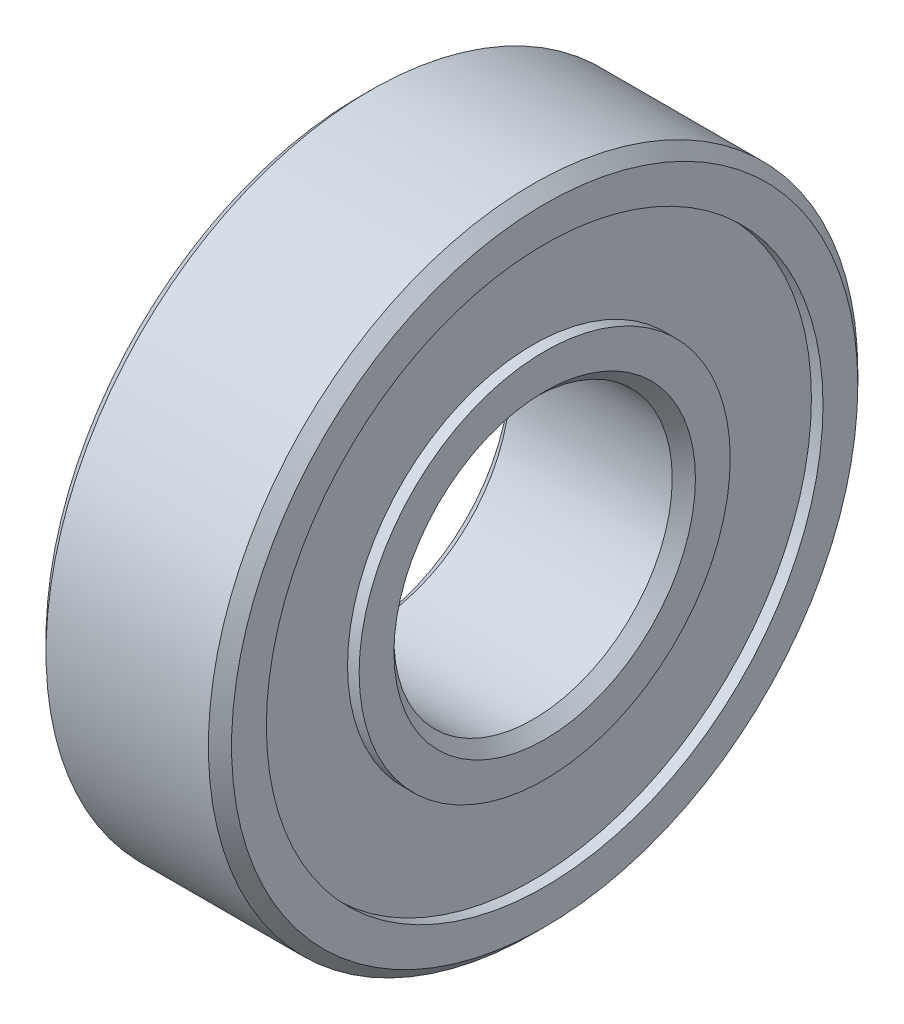
from build123d import *

# Parameters (mm, degrees)
SKETCH1_R             = 14
SKETCH1_R_2           = 12
BOSS_EXTRUDE1_DEPTH   = 4
SKETCH1_R_3           = 8
SKETCH1_R_4           = 6
BOSS_EXTRUDE1_2_DEPTH = 4
SKETCH2_R             = 12
SKETCH2_R_2           = 8
BOSS_EXTRUDE2_DEPTH   = 3.5
CHAMFER1_SIZE         = 0.5
CHAMFER2_SIZE         = 0.5


with BuildPart() as part:
    # Sketch1 → Boss-Extrude1 (new, symmetric)
    with BuildSketch(Plane(origin=(0, 0, 0), x_dir=(0, 0, -1), z_dir=(1, 0, 0))):
        Circle(SKETCH1_R)
        Circle(SKETCH1_R_2, mode=Mode.SUBTRACT)
    extrude(amount=BOSS_EXTRUDE1_DEPTH, both=True)

    # Chamfer1
    chamfer1_edges = [part.edges().sort_by_distance(p)[0] for p in [
        (-4, 0, 14),
        (4, 0, 14),
    ]]
    chamfer(chamfer1_edges, length=CHAMFER1_SIZE)


with BuildPart() as body_2:
    # Sketch1 → Boss-Extrude1 2 (new, symmetric)
    with BuildSketch(Plane(origin=(0, 0, 0), x_dir=(0, 0, -1), z_dir=(1, 0, 0))):
        Circle(SKETCH1_R_3)
        Circle(SKETCH1_R_4, mode=Mode.SUBTRACT)
    extrude(amount=BOSS_EXTRUDE1_2_DEPTH, both=True)

    # Chamfer2
    chamfer2_edges = [body_2.edges().sort_by_distance(p)[0] for p in [
        (-4, 0, 6),
        (4, 0, 6),
    ]]
    chamfer(chamfer2_edges, length=CHAMFER2_SIZE)


with BuildPart() as body_3:
    # Sketch2 → Boss-Extrude2 (new, symmetric)
    with BuildSketch(Plane.ZY):
        Circle(SKETCH2_R)
        Circle(SKETCH2_R_2, mode=Mode.SUBTRACT)
    extrude(amount=BOSS_EXTRUDE2_DEPTH, both=True)


solid = Compound([part.part, body_2.part, body_3.part])
